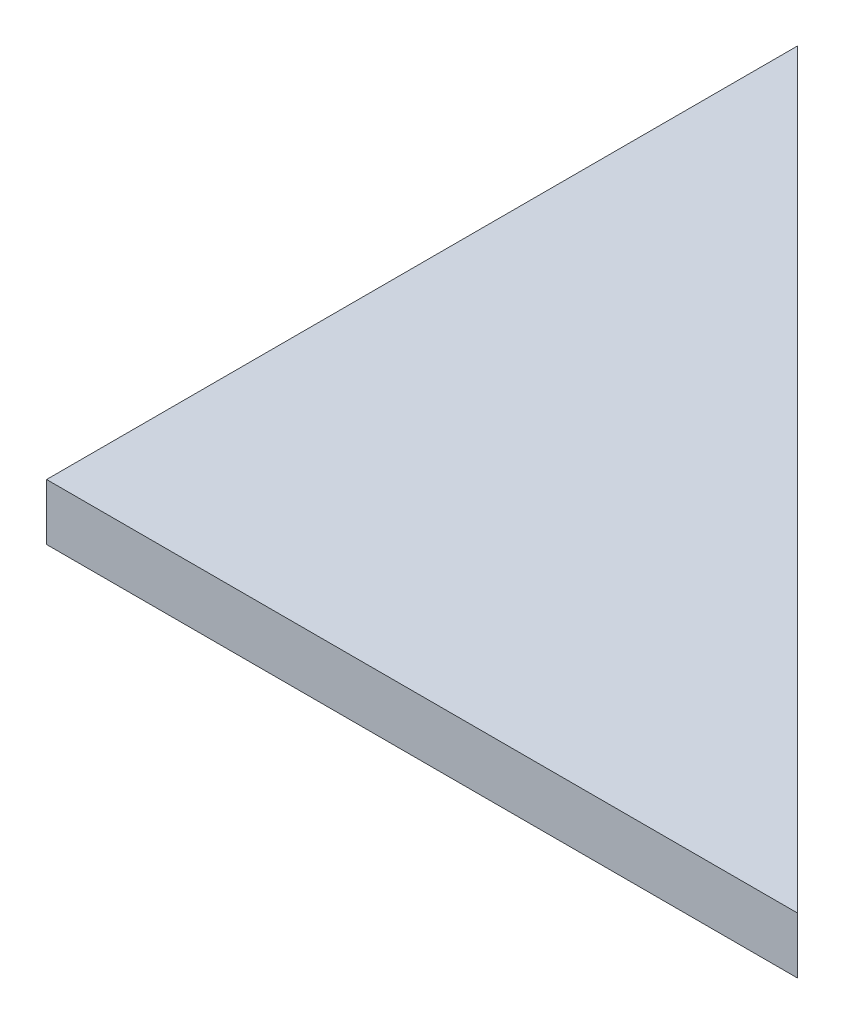
from build123d import *

# Parameters (mm, degrees)
BOSS_EXTRUDE1_DEPTH = 1.5


with BuildPart() as part:
    # Sketch1 → Boss-Extrude1 (new body)
    with BuildSketch(Plane(origin=(0, 0, 0), x_dir=(1, 0, 0), z_dir=(0, 1, 0))):
        Polygon((0, 0), (20, 0), (0, 20), align=None)
    extrude(amount=BOSS_EXTRUDE1_DEPTH)


solid = part.part
